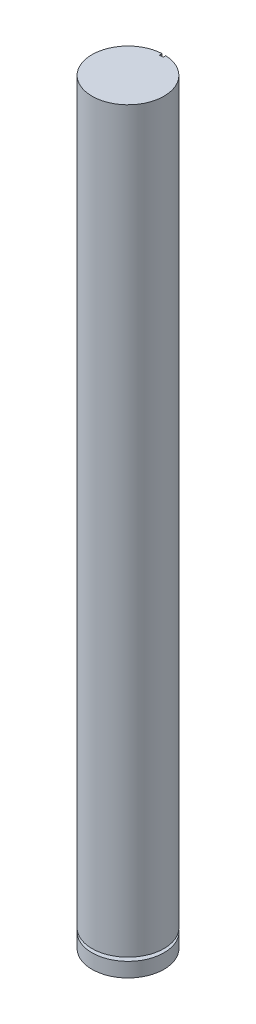
from build123d import *

# Parameters (mm, degrees)
SKETCH1_R           = 2
BOSS_EXTRUDE1_DEPTH = 42
SKETCH2_W           = 0.5
SKETCH2_H           = 0.2
SKETCH3_W           = 0.2
SKETCH3_H           = 0.15
CUT_EXTRUDE1_DEPTH  = 3


with BuildPart() as part:
    # Sketch1 → Boss-Extrude1 (new body)
    with BuildSketch(Plane(origin=(0, 0, 0), x_dir=(1, 0, 0), z_dir=(0, 1, 0))):
        with Locations(Location((0, 0, 0), (0, 0, 90))):
            Circle(SKETCH1_R)
    extrude(amount=BOSS_EXTRUDE1_DEPTH)

    # Sketch2 → Cut-Revolve1 (revolve, cut)
    with BuildSketch(Plane(origin=(0, 0, 0), x_dir=(0, 0, -1), z_dir=(1, 0, 0))):
        with Locations((1.75, 0.9)):
            Rectangle(SKETCH2_W, SKETCH2_H)
    revolve(axis=Axis((0, 3.062104398, 0), (0, -1, 0)), mode=Mode.SUBTRACT)

    # Sketch3 → Cut-Extrude1 (cut)
    with BuildSketch(Plane(origin=(0, 42, 0), x_dir=(1, 0, 0), z_dir=(0, 1, 0))):
        with Locations((0, 1.925)):
            Rectangle(SKETCH3_W, SKETCH3_H)
    extrude(amount=-CUT_EXTRUDE1_DEPTH, mode=Mode.SUBTRACT)


solid = part.part
